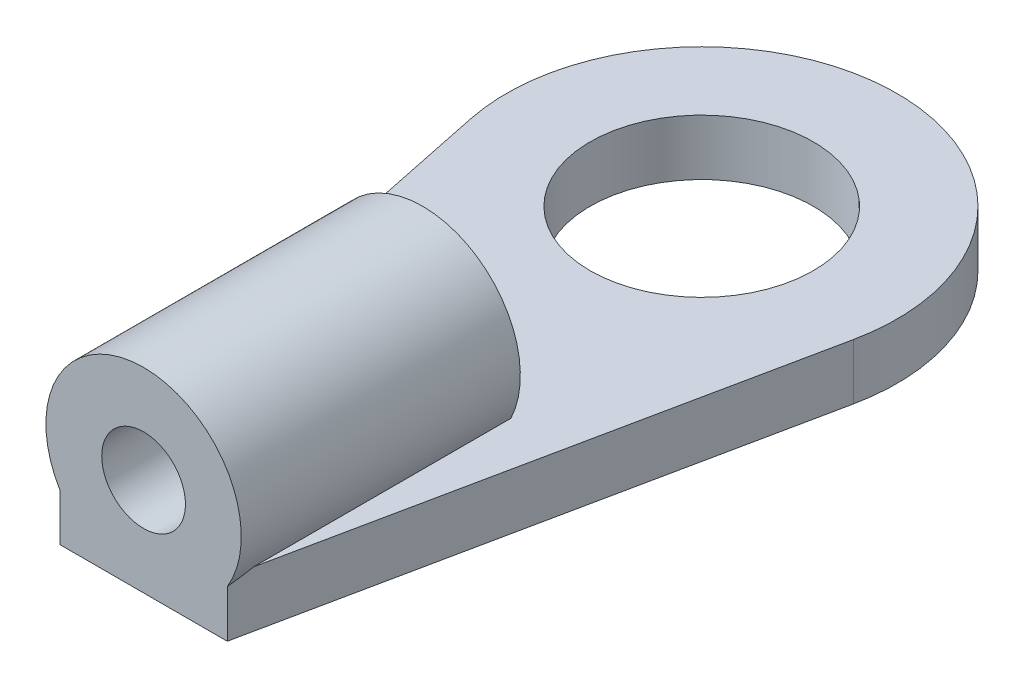
from build123d import *

# Parameters (mm, degrees)
SKETCH_1_R          = 2
EXTRUDE_1_DEPTH     = 1
EXTRUDE_START       = 10
SKETCH_2_R          = 1.75
EXTRUDE_2_DEPTH     = 5
SKETCH_3_R          = 0.75
CUT_EXTRUDE_1_DEPTH = 5


with BuildPart() as part:
    # 草图1 → 凸台-拉伸1 (new body)
    with BuildSketch(Plane(origin=(0, 0, 0), x_dir=(1, 0, 0), z_dir=(0, 1, 0))):
        with BuildLine():
            Line((-1.5, -10), (1.5, -10))
            Line((1.5, -10), (3.427033294, -0.710945006))
            ThreePointArc((3.427033294, -0.710945006), (0, 3.5), (-3.427033294, -0.710945006))
            Line((-3.427033294, -0.710945006), (-1.5, -10))
        make_face()
        with Locations(Location((0, 0, 0), (0, 0, 270))):
            Circle(SKETCH_1_R, mode=Mode.SUBTRACT)
    extrude(amount=EXTRUDE_1_DEPTH)

    # 草图2 → 凸台-拉伸2 (add)
    with BuildSketch(Plane.XY.offset(EXTRUDE_START)):
        with Locations((0, 1.75)):
            Circle(SKETCH_2_R)
    extrude(amount=-EXTRUDE_2_DEPTH)

    # 草图3 → 切除-拉伸1 (cut)
    with BuildSketch(Plane(origin=(0, 0, 5), x_dir=(-1, 0, 0), z_dir=(0, 0, -1))):
        with Locations((0, 1.75)):
            Circle(SKETCH_3_R)
    extrude(amount=-CUT_EXTRUDE_1_DEPTH, mode=Mode.SUBTRACT)


solid = part.part
